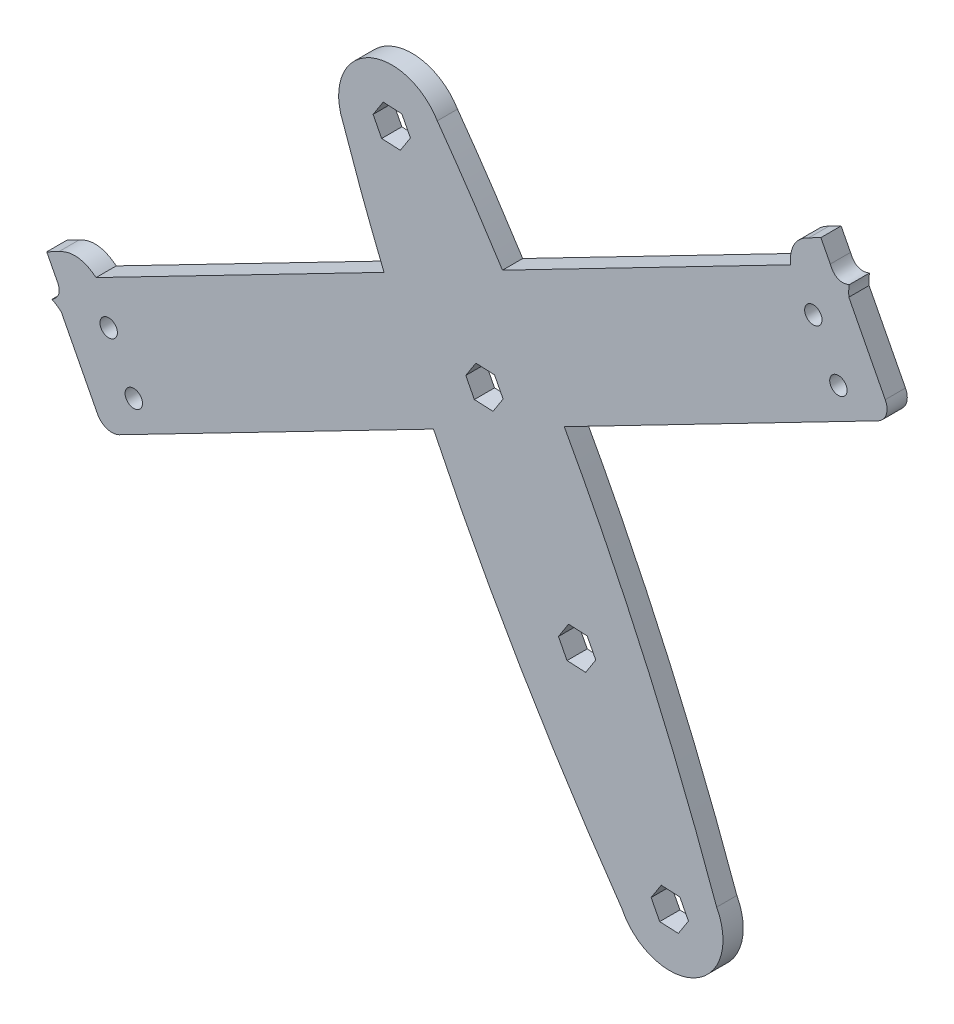
from build123d import *

# Parameters (mm, degrees)
BOSS_EXTRUDE1_DEPTH = 5
SKETCH4_R           = 2.15
BOSS_EXTRUDE2_DEPTH = 5


with BuildPart() as part:
    # Sketch3 → Boss-Extrude1 (new body)
    with BuildSketch(Plane.XY):
        with BuildLine():
            ThreePointArc((16.161070517, 9.296643019), (-1.117119854, 14.203399989), (-7.139484482, -2.718279914))
            add(Edge.make_bspline(
                [(-7.139484482, -2.718279914), (9.132754629, -50.436524862), (33.087399733, -95.298268059), (61.843065412, -136.60626672)],
                knots=[0, 0, 0, 0, 1, 1, 1, 1], degree=3))
            ThreePointArc((61.843065412, -136.60626672), (79.680701211, -142.48791497), (85.233269402, -124.545116316))
            add(Edge.make_bspline(
                [(16.161070517, 9.296643019), (45.599741143, -31.632336181), (68.256168937, -77.163504674), (85.233269402, -124.545116316)],
                knots=[0, 0, 0, 0, 1, 1, 1, 1], degree=3))
        make_face()
        Polygon((78.262696046, -131.010190899), (76.145869285, -126.905026127), (71.532278927, -126.685669492), (69.035515328, -130.571477627), (71.152342089, -134.676642399), (75.765932447, -134.895999034), align=None, mode=Mode.SUBTRACT)
        Polygon((55.347374171, -86.570478665), (53.230547411, -82.465313894), (48.616957052, -82.245957258), (46.120193454, -86.131765394), (48.237020214, -90.236930165), (52.850610573, -90.456286801), align=None, mode=Mode.SUBTRACT)
        Polygon((32.432052297, -42.130766432), (30.315225536, -38.025601661), (25.701635178, -37.806245025), (23.204871579, -41.69205316), (25.32169834, -45.797217932), (29.935288698, -46.016574567), align=None, mode=Mode.SUBTRACT)
        Polygon((9.516730422, 2.308945802), (7.399903662, 6.414110573), (2.786313303, 6.633467209), (0.289549705, 2.747659073), (2.406376465, -1.357505698), (7.019966824, -1.576862334), align=None, mode=Mode.SUBTRACT)
    extrude(amount=BOSS_EXTRUDE1_DEPTH)

    # Sketch4 → Boss-Extrude2 (add)
    # profile 1 of 2: a face of its own
    with BuildSketch(Plane.XY.offset(5)):
        with BuildLine():
            Line((-62.450693281, -97.22736689), (15.220358234, -57.176316709))
            add(Edge.make_bspline(
                [(2.997808313, -29.725276343), (6.797307694, -38.99575652), (10.8790517, -48.14793286), (15.220358234, -57.176316709)],
                knots=[0.19087071, 0.19087071, 0.19087071, 0.19087071, 0.389797815, 0.389797815, 0.389797815, 0.389797815], degree=3))
            Line((2.997808313, -29.725276343), (-68.216036929, -66.446670398))
            add(Edge.make_bspline(
                [(-77.409704675, -65.483914752), (-72.739634543, -62.850222111), (-68.216036929, -66.446670398)],
                knots=[0, 0, 0, 1, 1, 1], degree=2))
            Line((-77.409704675, -65.483914752), (-80.411912193, -67.033578992))
            Line((-80.411912193, -67.033578992), (-78.087434927, -71.536853276))
            add(Edge.make_bspline(
                [(-79.1174503, -76.560041992), (-76.157677443, -74.63824268), (-78.087434927, -71.536853276)],
                knots=[0.011104225, 0.011104225, 0.011104225, 1, 1, 1], degree=2))
            add(Edge.make_bspline(
                [(-76.835042304, -78.059565803), (-77.986988957, -77.094288184), (-79.1174503, -76.560041992)],
                knots=[0, 0, 0, 1, 1, 1], degree=2))
            Line((-76.835042304, -78.059565803), (-67.839096009, -95.50541566))
            ThreePointArc((-67.839096009, -95.50541566), (-65.501522422, -97.48236602), (-62.450693281, -97.22736689))
        make_face()
        with Locations((-58.886757215, -87.65648791)):
            Circle(SKETCH4_R, mode=Mode.SUBTRACT)
        with Locations((-65.092650278, -75.633639142)):
            Circle(SKETCH4_R, mode=Mode.SUBTRACT)
    # profile 2 of 2: a face of its own
    with BuildSketch(Plane.XY.offset(5)):
        with BuildLine():
            add(Edge.make_bspline(
                [(32.280750269, -14.617843465), (37.629854463, -23.089001057), (42.718912178, -31.721489708), (47.556604904, -40.493649318)],
                knots=[0.190825277, 0.190825277, 0.190825277, 0.190825277, 0.38974783, 0.38974783, 0.38974783, 0.38974783], degree=3))
            Line((47.556604904, -40.493649318), (125.205794469, -0.413084682))
            ThreePointArc((125.205794469, -0.413084682), (127.181774896, 1.925308859), (126.925510125, 4.976031949))
            Line((126.925510125, 4.976031949), (117.922327039, 22.418148257))
            add(Edge.make_bspline(
                [(117.922327039, 22.418148257), (117.803338747, 23.916341756), (118.02315462, 25.147212514)],
                knots=[0, 0, 0, 1, 1, 1], degree=2))
            add(Edge.make_bspline(
                [(118.02315462, 25.147212514), (114.741637832, 23.849053997), (113.332685388, 27.219133104)],
                knots=[0.011104225, 0.011104225, 0.011104225, 1, 1, 1], degree=2))
            Line((113.332685388, 27.219133104), (111.010076543, 31.723371329))
            Line((111.010076543, 31.723371329), (108.007226392, 30.174952712))
            add(Edge.make_bspline(
                [(108.007226392, 30.174952712), (103.154331871, 27.895631161), (103.463399948, 22.124855428)],
                knots=[0, 0, 0, 1, 1, 1], degree=2))
            Line((103.463399948, 22.124855428), (32.280750269, -14.617843465))
        make_face()
        with Locations((115.340727562, 2.229607059)):
            Circle(SKETCH4_R, mode=Mode.SUBTRACT)
        with Locations((109.139822812, 14.255029359)):
            Circle(SKETCH4_R, mode=Mode.SUBTRACT)
    extrude(amount=-BOSS_EXTRUDE2_DEPTH)


solid = part.part
